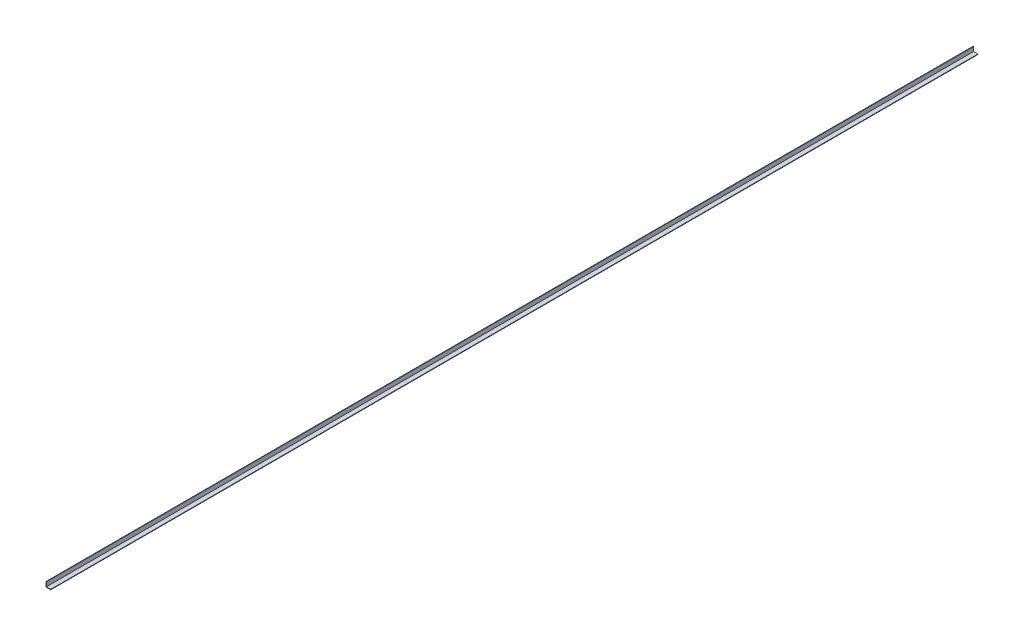
from build123d import *

# Parameters (mm, degrees)
SALIENTE_EXTRUIR1_DEPTH = 6100


with BuildPart() as part:
    # Croquis1 → Saliente-Extruir1 (new body)
    with BuildSketch(Plane.XY):
        Polygon((0, 31.75), (0, 0), (31.75, 0), (31.75, 3.18), (3.18, 3.18), (3.18, 31.75), align=None)
    extrude(amount=-SALIENTE_EXTRUIR1_DEPTH)


solid = part.part
